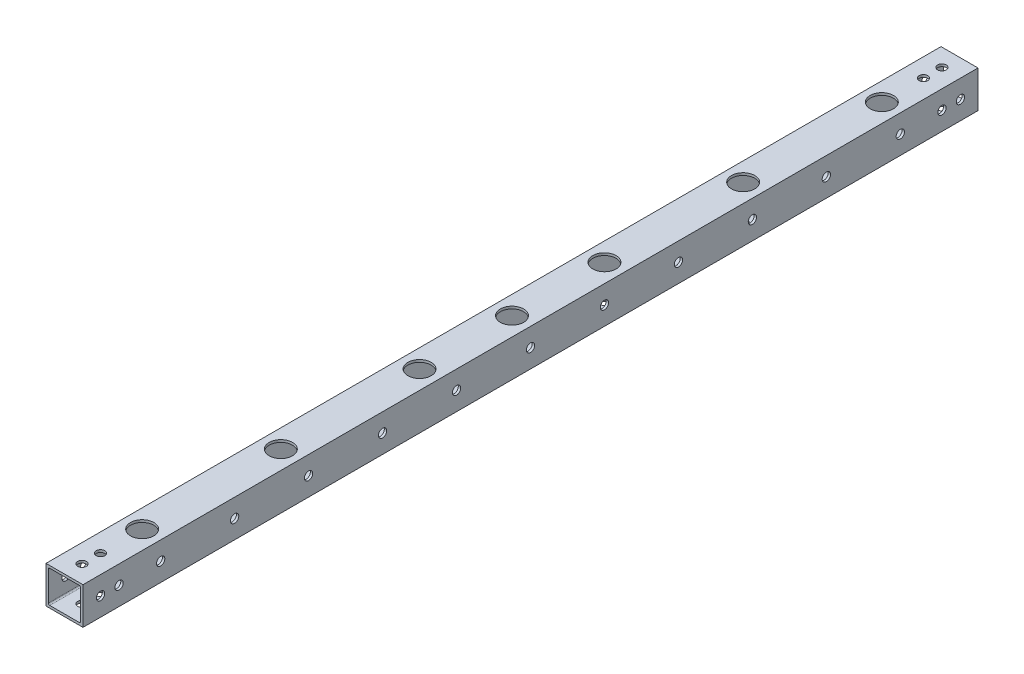
from build123d import *

# Parameters (mm, degrees)
CROQUIS1_W              = 20
CROQUIS1_H              = 20
CROQUIS1_W_2            = 17.4
CROQUIS1_H_2            = 17.4
SALIENTE_EXTRUIR2_DEPTH = 242
FILLET1_R               = 0.75
SKETCH1_R               = 2.35
CUT_EXTRUDE1_DEPTH      = 244.030862238
SKETCH2_R               = 2.25
CUT_EXTRUDE4_DEPTH      = 244.030862238
SKETCH2_5_R             = 6.3
SKETCH2_5_R_2           = 2.25
CUT_EXTRUDE5_DEPTH      = 5
SKETCH3_R               = 2.25
CUT_EXTRUDE6_DEPTH      = 5
SKETCH4_R               = 6.3
CUT_EXTRUDE7_DEPTH      = 5
SKETCH3_2_R             = 2.25
CUT_EXTRUDE8_DEPTH      = 244.030862238


with BuildPart() as part:
    # Croquis1 → Saliente-Extruir2 (new, symmetric)
    with BuildSketch(Plane.XY):
        Rectangle(CROQUIS1_W, CROQUIS1_H)
        Rectangle(CROQUIS1_W_2, CROQUIS1_H_2, mode=Mode.SUBTRACT)
    extrude(amount=SALIENTE_EXTRUIR2_DEPTH, both=True)

    # Fillet1
    fillet1_edges = [part.edges().sort_by_distance(p)[0] for p in [
        (-8.7, 8.7, 0),
        (-8.7, -8.7, 0),
        (8.7, -8.7, 0),
        (8.7, 8.7, 0),
    ]]
    fillet(fillet1_edges, radius=FILLET1_R)

    # Sketch1 → Cut-Extrude1 (cut, through all)
    with BuildSketch(Plane(origin=(0, 10, 0), x_dir=(1, 0, 0), z_dir=(0, 1, 0))):
        with Locations(Location((0, -232.5, 0), (0, 0, 270))):
            Circle(SKETCH1_R)
        with Locations(Location((0, -222.5, 0), (0, 0, 270))):
            Circle(SKETCH1_R)
        with Locations(Location((0, 222.5, 0), (0, 0, 270))):
            Circle(SKETCH1_R)
        with Locations(Location((0, 232.5, 0), (0, 0, 270))):
            Circle(SKETCH1_R)
    extrude(amount=-CUT_EXTRUDE1_DEPTH, mode=Mode.SUBTRACT)

    # Sketch2 → Cut-Extrude4 (cut, through all)
    with BuildSketch(Plane(origin=(0, 10, 0), x_dir=(0, 0, -1), z_dir=(0, -1, 0))):
        with Locations(Location((200, 0, 0), (0, 0, 180))):
            Circle(SKETCH2_R)
        with Locations((-200, 0)):
            Circle(SKETCH2_R)
        with Locations((-125, 0)):
            Circle(SKETCH2_R)
        with Locations((-50, 0)):
            Circle(SKETCH2_R)
        Circle(SKETCH2_R)
        with Locations((50, 0)):
            Circle(SKETCH2_R)
        with Locations((125, 0)):
            Circle(SKETCH2_R)
    extrude(amount=CUT_EXTRUDE4_DEPTH, mode=Mode.SUBTRACT)

    # Sketch2<5> → Cut-Extrude5 (cut)
    # profile 1 of 7: a face of its own
    with BuildSketch(Plane(origin=(0, 10, 0), x_dir=(0, 0, -1), z_dir=(0, -1, 0))):
        with Locations(Location((-125, 0, 0), (0, 0, 180))):
            Circle(SKETCH2_5_R)
        with Locations(Location((-125, 0, 0), (0, 0, 180))):
            Circle(SKETCH2_5_R_2, mode=Mode.SUBTRACT)
    # profile 2 of 7: a face of its own
    with BuildSketch(Plane(origin=(0, 10, 0), x_dir=(0, 0, -1), z_dir=(0, -1, 0))):
        with Locations((-200, 0)):
            Circle(SKETCH2_5_R)
    # profile 3 of 7: a face of its own
    with BuildSketch(Plane(origin=(0, 10, 0), x_dir=(0, 0, -1), z_dir=(0, -1, 0))):
        with Locations((-50, 0)):
            Circle(SKETCH2_5_R)
    # profile 4 of 7: a face of its own
    with BuildSketch(Plane(origin=(0, 10, 0), x_dir=(0, 0, -1), z_dir=(0, -1, 0))):
        Circle(SKETCH2_5_R)
    # profile 5 of 7: a face of its own
    with BuildSketch(Plane(origin=(0, 10, 0), x_dir=(0, 0, -1), z_dir=(0, -1, 0))):
        with Locations((50, 0)):
            Circle(SKETCH2_5_R)
    # profile 6 of 7: a face of its own
    with BuildSketch(Plane(origin=(0, 10, 0), x_dir=(0, 0, -1), z_dir=(0, -1, 0))):
        with Locations((125, 0)):
            Circle(SKETCH2_5_R)
    # profile 7 of 7: a face of its own
    with BuildSketch(Plane(origin=(0, 10, 0), x_dir=(0, 0, -1), z_dir=(0, -1, 0))):
        with Locations((200, 0)):
            Circle(SKETCH2_5_R)
    extrude(amount=CUT_EXTRUDE5_DEPTH, mode=Mode.SUBTRACT)

    # Sketch3 → Cut-Extrude6 (cut)
    with BuildSketch(Plane.ZY.offset(-10)):
        Circle(SKETCH3_R)
        with Locations((40, 0)):
            Circle(SKETCH3_R)
        with Locations((80, 0)):
            Circle(SKETCH3_R)
        with Locations((120, 0)):
            Circle(SKETCH3_R)
        with Locations((160, 0)):
            Circle(SKETCH3_R)
        with Locations((-40, 0)):
            Circle(SKETCH3_R)
        with Locations((-80, 0)):
            Circle(SKETCH3_R)
        with Locations((-120, 0)):
            Circle(SKETCH3_R)
        with Locations((-160, 0)):
            Circle(SKETCH3_R)
        with Locations((-200, 0)):
            Circle(SKETCH3_R)
        with Locations((200, 0)):
            Circle(SKETCH3_R)
        with Locations((-232.5, 0)):
            Circle(SKETCH3_R)
        with Locations((-222.5, 0)):
            Circle(SKETCH3_R)
        with Locations((232.5, 0)):
            Circle(SKETCH3_R)
        with Locations((222.5, 0)):
            Circle(SKETCH3_R)
    extrude(amount=CUT_EXTRUDE6_DEPTH, mode=Mode.SUBTRACT)

    # Sketch4 → Cut-Extrude7 (cut)
    with BuildSketch(Plane.ZY.offset(10)):
        with Locations(Location((-160, 0, 0), (0, 0, 270))):
            Circle(SKETCH4_R)
        with Locations(Location((-80, 0, 0), (0, 0, 270))):
            Circle(SKETCH4_R)
        with Locations(Location((80, 0, 0), (0, 0, 270))):
            Circle(SKETCH4_R)
        with Locations(Location((160, 0, 0), (0, 0, 270))):
            Circle(SKETCH4_R)
    extrude(amount=-CUT_EXTRUDE7_DEPTH, mode=Mode.SUBTRACT)

    # Sketch3<2> → Cut-Extrude8 (cut, through all)
    with BuildSketch(Plane.ZY.offset(-10)):
        with Locations((-232.5, 0)):
            Circle(SKETCH3_2_R)
        with Locations((-222.5, 0)):
            Circle(SKETCH3_2_R)
        with Locations((232.5, 0)):
            Circle(SKETCH3_2_R)
        with Locations((222.5, 0)):
            Circle(SKETCH3_2_R)
    extrude(amount=CUT_EXTRUDE8_DEPTH, mode=Mode.SUBTRACT)


solid = part.part
